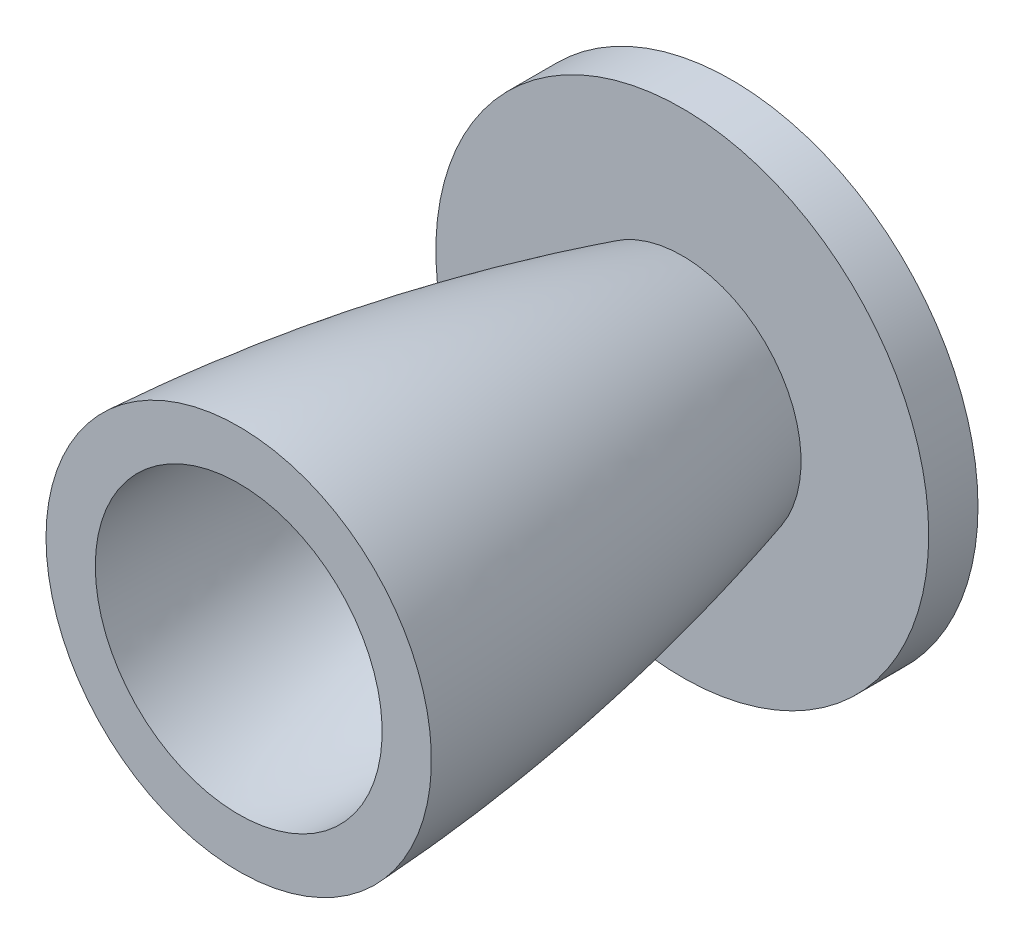
from build123d import *

# Parameters (mm, degrees)
SKETCH1_R           = 500
BOSS_EXTRUDE1_DEPTH = 100


with BuildPart() as part:
    # Sketch1 → Boss-Extrude1 (new body)
    with BuildSketch(Plane.XY):
        Circle(SKETCH1_R)
    extrude(amount=BOSS_EXTRUDE1_DEPTH)

    # Sketch2 → Revolve2 (revolve)
    with BuildSketch(Plane(origin=(0, 0, 0), x_dir=(1, 0, 0), z_dir=(0, 1, 0)), mode=Mode.PRIVATE) as revolve2_sk:
        with BuildLine():
            Line((191.001086436, -281.617154631), (91.001086436, -281.617154631))
            Line((91.001086436, -281.617154631), (91.001086436, -100))
            Line((91.001086436, -100), (241.001086436, -100))
            add(Edge.make_bspline(
                [(241.001086436, -100), (365.645053483, -541.844977323), (391.001086436, -1000)],
                knots=[0, 0, 0, 1, 1, 1], degree=2))
            Line((391.001086436, -1000), (291.001086436, -1000))
            add(Edge.make_bspline(
                [(191.001086436, -281.617154631), (305.655000956, -631.798317471), (291.001086436, -1000)],
                knots=[0, 0, 0, 1, 1, 1], degree=2))
        make_face()
    revolve(revolve2_sk.sketch.rotate(Axis((0, 0, -166.849755885), (0, 0, 1)), 180), axis=Axis((0, 0, -166.849755885), (0, 0, 1)))


solid = part.part
